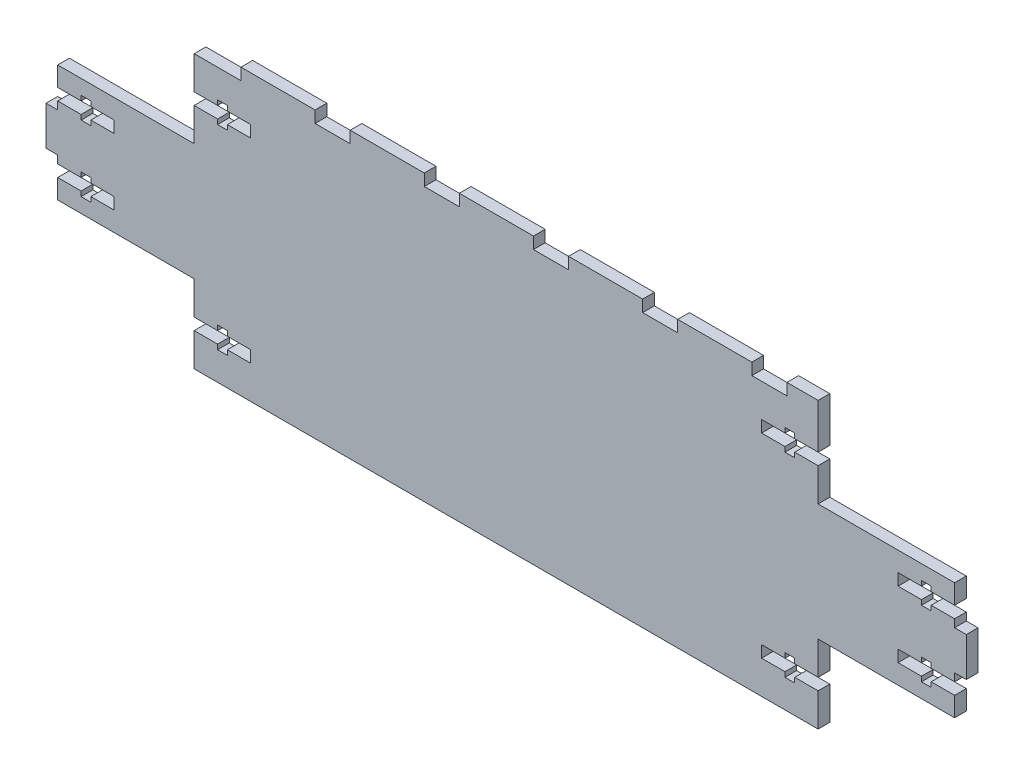
from build123d import *

# Parameters (mm, degrees)
SKETCH_1_W             = 160
SKETCH_1_H             = 70
EXTRUDE_1_DEPTH        = 3
EXTRUDE_2_DEPTH        = 35
EXTRUDE_2_DEPTH_BACK   = 195
SKETCH_2_W             = 3
SKETCH_2_H             = 30
EXTRUDE_3_DEPTH        = 3
EXTRUDE_3_DEPTH_BACK   = 233
SKETCH_3_W             = 3
SKETCH_3_H             = 10
CUT_EXTRUDE_1_DEPTH    = 3
CUT_EXTRUDE_2_DEPTH    = 3
SKETCH_6_W             = 8
SKETCH_6_H             = 3
EXTRUDE_4_DEPTH        = 3
SKETCH_7_W             = 19
SKETCH_7_H             = 3
EXTRUDE_5_DEPTH        = 3
PATTERN_LINEAR_1_COUNT = 5
PATTERN_LINEAR_1_PITCH = 28


with BuildPart() as part:
    # Эскиз1 → Бобышка-Вытянуть1 (new body)
    with BuildSketch(Plane.XY):
        with Locations((80, 35)):
            Rectangle(SKETCH_1_W, SKETCH_1_H)
    extrude(amount=EXTRUDE_1_DEPTH)

    # Эскиз2 → Бобышка-Вытянуть2 (add, two sides: drawn at the far end of the back side and taken through both)
    with BuildSketch(Plane(origin=(160, 0, 0), x_dir=(0, 0, -1), z_dir=(1, 0, 0)).offset(-EXTRUDE_2_DEPTH_BACK)):
        with Locations((-1.5, 35)):
            Rectangle(SKETCH_2_W, SKETCH_2_H)
    extrude(amount=EXTRUDE_2_DEPTH + EXTRUDE_2_DEPTH_BACK)

    # Эскиз3 → Бобышка-Вытянуть3 (add, two sides: drawn at the far end of the back side and taken through both)
    with BuildSketch(Plane(origin=(195, 0, 0), x_dir=(0, 0, -1), z_dir=(1, 0, 0)).offset(-EXTRUDE_3_DEPTH_BACK)):
        with Locations((-1.5, 35)):
            Rectangle(SKETCH_3_W, SKETCH_3_H)
    extrude(amount=EXTRUDE_3_DEPTH + EXTRUDE_3_DEPTH_BACK)

    # Эскиз4 → Вырез-Вытянуть1 (cut)
    with BuildSketch(Plane.XY.offset(3)):
        Polygon((160, 58.5), (154, 58.5), (154, 57.25), (151.5, 57.25), (151.5, 58.5), (145.5, 58.5), (145.5, 61.5), (151.5, 61.5), (151.5, 62.75), (154, 62.75), (154, 61.5), (160, 61.5), align=None)
        Polygon((160, 8.5), (160, 11.5), (154, 11.5), (154, 12.75), (151.5, 12.75), (151.5, 11.5), (145.5, 11.5), (145.5, 8.5), (151.5, 8.5), (151.5, 7.25), (154, 7.25), (154, 8.5), align=None)
        Polygon((0, 11.5), (6, 11.5), (6, 12.75), (8.5, 12.75), (8.5, 11.5), (14.5, 11.5), (14.5, 8.5), (8.5, 8.5), (8.5, 7.25), (6, 7.25), (6, 8.5), (0, 8.5), align=None)
        Polygon((0, 61.5), (0, 58.5), (6, 58.5), (6, 57.25), (8.5, 57.25), (8.5, 58.5), (14.5, 58.5), (14.5, 61.5), (8.5, 61.5), (8.5, 62.75), (6, 62.75), (6, 61.5), align=None)
    extrude(amount=-CUT_EXTRUDE_1_DEPTH, mode=Mode.SUBTRACT)

    # Эскиз5 → Вырез-Вытянуть2 (cut)
    with BuildSketch(Plane.XY.offset(3)):
        Polygon((195, 45), (189, 45), (189, 46.25), (186.5, 46.25), (186.5, 45), (180.5, 45), (180.5, 42), (186.5, 42), (186.5, 40.75), (189, 40.75), (189, 42), (195, 42), align=None)
        Polygon((195, 28), (195, 25), (189, 25), (189, 23.75), (186.5, 23.75), (186.5, 25), (180.5, 25), (180.5, 28), (186.5, 28), (186.5, 29.25), (189, 29.25), (189, 28), align=None)
        Polygon((-35, 25), (-29, 25), (-29, 23.75), (-26.5, 23.75), (-26.5, 25), (-20.5, 25), (-20.5, 28), (-26.5, 28), (-26.5, 29.25), (-29, 29.25), (-29, 28), (-35, 28), align=None)
        Polygon((-35, 42), (-35, 45), (-29, 45), (-29, 46.25), (-26.5, 46.25), (-26.5, 45), (-20.5, 45), (-20.5, 42), (-26.5, 42), (-26.5, 40.75), (-29, 40.75), (-29, 42), align=None)
    extrude(amount=-CUT_EXTRUDE_2_DEPTH, mode=Mode.SUBTRACT)

    # Эскиз6 → Бобышка-Вытянуть4 (add)
    with BuildSketch(Plane(origin=(0, 70, 0), x_dir=(1, 0, 0), z_dir=(0, 1, 0))):
        with Locations((156, -1.5)):
            Rectangle(SKETCH_6_W, SKETCH_6_H)
    extrude(amount=EXTRUDE_4_DEPTH)

    # Эскиз7 → Бобышка-Вытянуть5 (add)
    with BuildSketch(Plane(origin=(0, 70, 0), x_dir=(1, 0, 0), z_dir=(0, 1, 0))):
        with Locations((133.5, -1.5)):
            Rectangle(SKETCH_7_W, SKETCH_7_H)
    extrude_5 = extrude(amount=EXTRUDE_5_DEPTH)

    # Линейный массив1: Бобышка-Вытянуть5 ×5
    with Locations(*[(-i * PATTERN_LINEAR_1_PITCH, 0, 0) for i in range(1, PATTERN_LINEAR_1_COUNT)]):
        add(extrude_5)


solid = part.part
